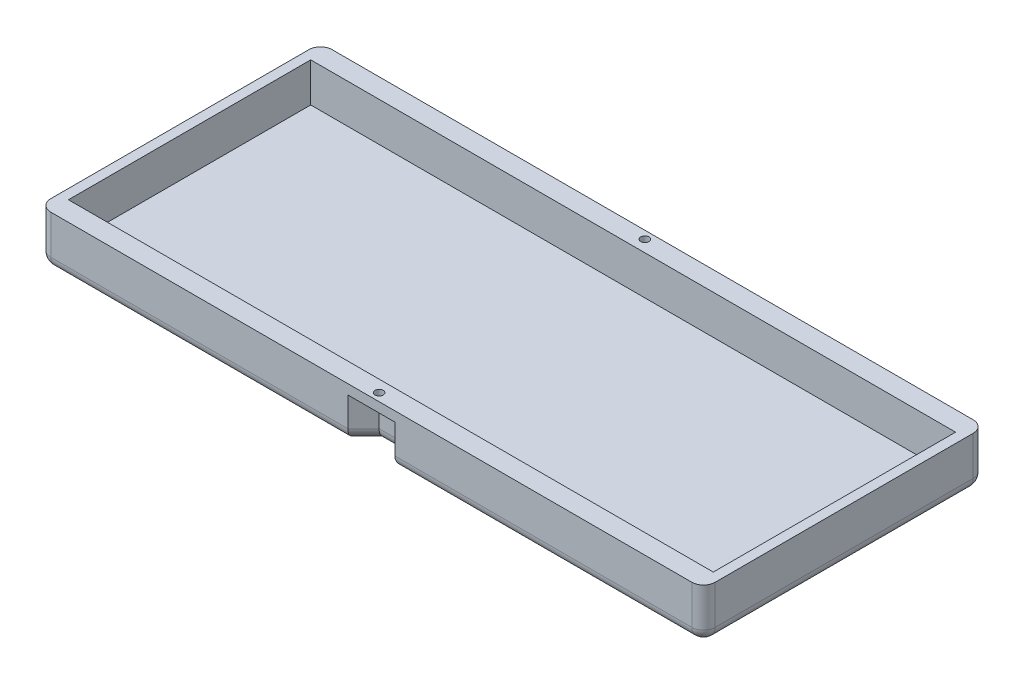
from build123d import *

# Parameters (mm, degrees)
SKETCH_1_W          = 170
SKETCH_1_H          = 72
EXTRUDE_1_DEPTH     = 3
SKETCH_2_W          = 170
SKETCH_2_H          = 72
SKETCH_2_W_2        = 165
SKETCH_2_H_2        = 62
EXTRUDE_2_DEPTH     = 10
CUT_EXTRUDE_1_DEPTH = 10.5
SKETCH_5_R          = 1.05
CUT_EXTRUDE_2_DEPTH = 10.5
SKETCH_6_R          = 1.05
CUT_EXTRUDE_3_DEPTH = 10.5
FILLET_1_R          = 3


with BuildPart() as part:
    # 草图1 → 凸台-拉伸1 (new body)
    with BuildSketch(Plane(origin=(0, 0, 0), x_dir=(1, 0, 0), z_dir=(0, 1, 0))):
        Rectangle(SKETCH_1_W, SKETCH_1_H)
    extrude(amount=EXTRUDE_1_DEPTH)

    # 草图2 → 凸台-拉伸2 (add)
    with BuildSketch(Plane(origin=(0, 3, 0), x_dir=(1, 0, 0), z_dir=(0, 1, 0))):
        Rectangle(SKETCH_2_W, SKETCH_2_H)
        Rectangle(SKETCH_2_W_2, SKETCH_2_H_2, mode=Mode.SUBTRACT)
    extrude(amount=EXTRUDE_2_DEPTH)

    # 草图3 → 切除-拉伸1 (cut)
    with BuildSketch(Plane.XZ):
        Polygon((-6, 36), (-2, 32), (2, 32), (6, 36), align=None)
        Polygon((6, -36), (-6, -36), (-2, -32), (2, -32), align=None)
    extrude(amount=-CUT_EXTRUDE_1_DEPTH, mode=Mode.SUBTRACT)

    # 草图5 → 切除-拉伸2 (cut)
    with BuildSketch(Plane.XZ.offset(-10.5)):
        with Locations(Location((0, 34, 0), (0, 0, 270))):
            Circle(SKETCH_5_R)
    extrude(amount=-CUT_EXTRUDE_2_DEPTH, mode=Mode.SUBTRACT)

    # 草图6 → 切除-拉伸3 (cut)
    with BuildSketch(Plane.XZ.offset(-10.5)):
        with Locations(Location((0, -34, 0), (0, 0, 270))):
            Circle(SKETCH_6_R)
    extrude(amount=-CUT_EXTRUDE_3_DEPTH, mode=Mode.SUBTRACT)

    # 圆角1
    fillet_1_edges = [part.edges().sort_by_distance(p)[0] for p in [
        (45.5, 0, 36),
        (-45.5, 0, -36),
        (-4, 0, 34),
        (0, 0, 32),
        (4, 0, 34),
        (-45.5, 0, 36),
        (4, 0, -34),
        (0, 0, -32),
        (-85, 0, 0),
        (-4, 0, -34),
        (45.5, 0, -36),
        (85, 0, 0),
        (85, 6.5, 36),
        (-85, 6.5, 36),
        (-85, 6.5, -36),
        (85, 6.5, -36),
    ]]
    fillet(fillet_1_edges, radius=FILLET_1_R)


solid = part.part
